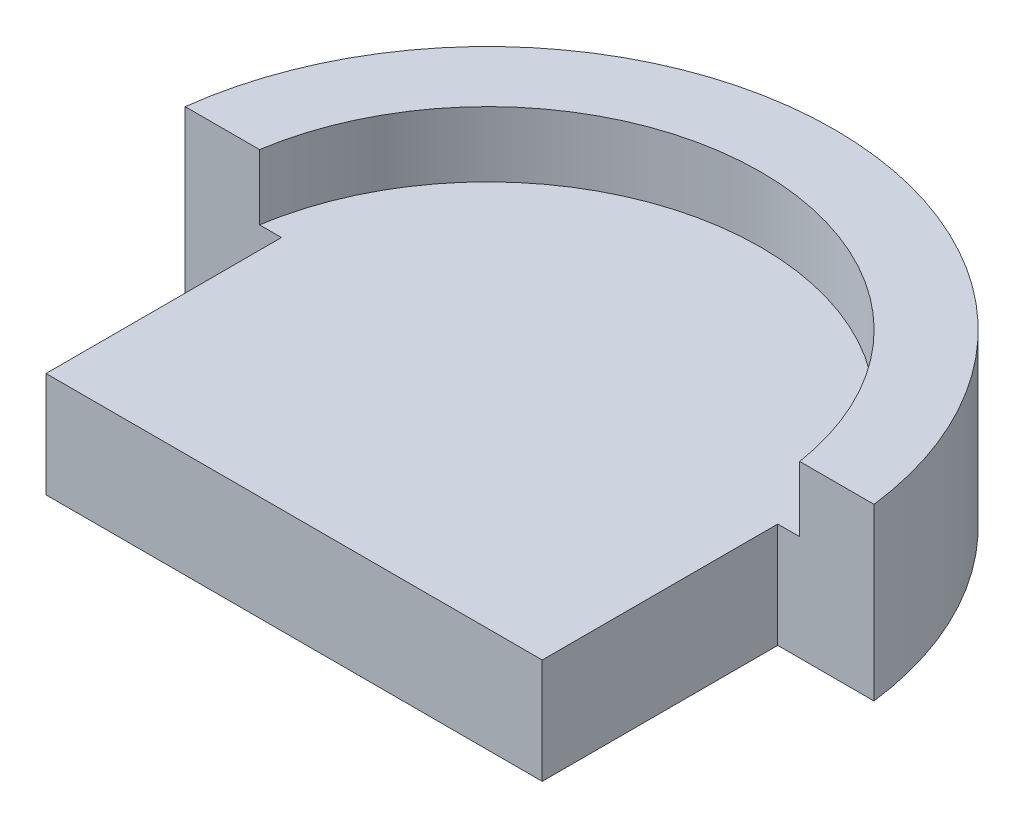
from build123d import *

# Parameters (mm, degrees)
EXTRUDE_1_DEPTH = 2.5
EXTRUDE_2_DEPTH = 1.55
SKETCH_3_R      = 0.5
EXTRUDE_3_DEPTH = 0.5


with BuildPart() as part:
    # 草图1 → 凸台-拉伸1 (new body)
    with BuildSketch(Plane(origin=(0, 0, 0), x_dir=(1, 0, 0), z_dir=(0, 1, 0))):
        with BuildLine():
            Line((-5.9, 0), (5.9, 0))
            Line((5.9, 0), (5.9, 5.6))
            Line((5.9, 5.6), (8.189169677, 5.6))
            ThreePointArc((8.189169677, 5.6), (0, 12.85), (-8.189169677, 5.6))
            Line((-8.189169677, 5.6), (-5.9, 5.6))
            Line((-5.9, 5.6), (-5.9, 0))
        make_face()
    extrude(amount=EXTRUDE_1_DEPTH)

    # 草图2 → 凸台-拉伸2 (add)
    with BuildSketch(Plane(origin=(0, 2.5, 0), x_dir=(1, 0, 0), z_dir=(0, 1, 0))):
        with BuildLine():
            Line((-8.189169677, 5.6), (-6.422616289, 5.6))
            ThreePointArc((-6.422616289, 5.6), (0, 11.1), (6.422616289, 5.6))
            Line((6.422616289, 5.6), (8.189169677, 5.6))
            ThreePointArc((8.189169677, 5.6), (0, 12.85), (-8.189169677, 5.6))
        make_face()
    extrude(amount=EXTRUDE_2_DEPTH)

    # 草图3 → 凸台-拉伸3 (add)
    with BuildSketch(Plane.XZ):
        with Locations(Location((-2.5, -4.1, 0), (0, 0, 90))):
            Circle(SKETCH_3_R)
        with Locations(Location((2.5, -4.1, 0), (0, 0, 90))):
            Circle(SKETCH_3_R)
    extrude(amount=EXTRUDE_3_DEPTH)


solid = part.part
